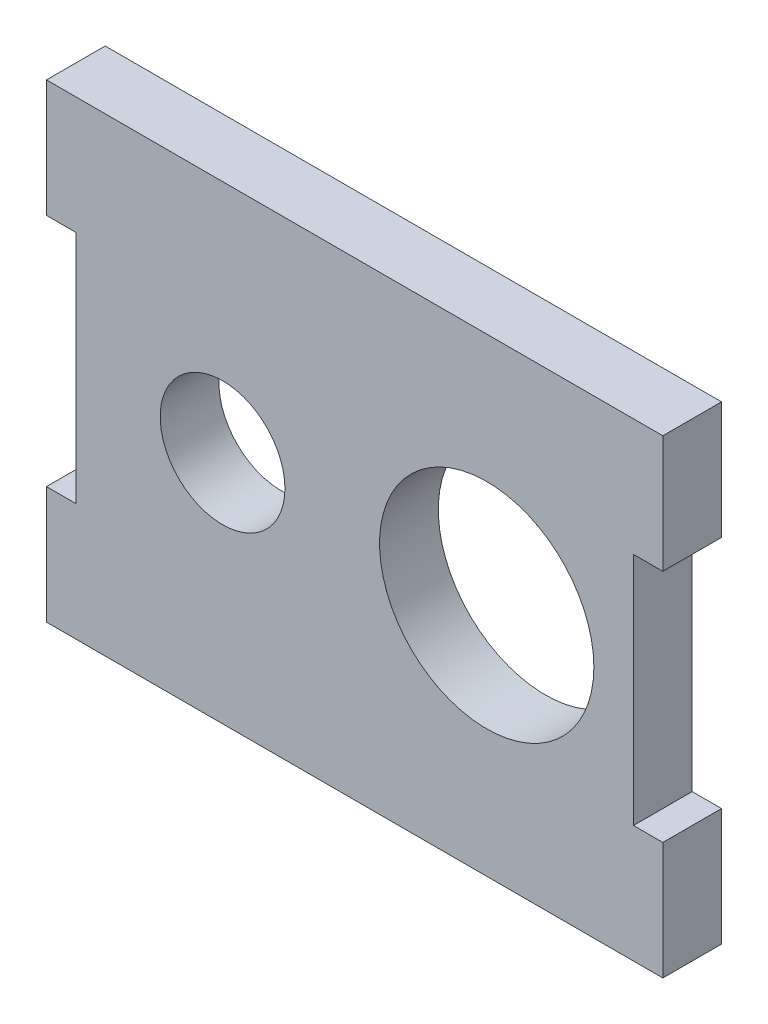
from build123d import *

# Parameters (mm, degrees)
SKETCH1_R      = 3.65
SKETCH1_R_2    = 2.125
EXTRUDE1_DEPTH = 2


with BuildPart() as part:
    # Sketch1 → Extrude1 (new body)
    with BuildSketch(Plane.XY):
        Polygon((543.697024667, -406.673514651), (522.697024667, -406.673514651), (522.697024667, -402.673514651), (523.697024667, -402.673514651), (523.697024667, -394.673514651), (522.697024667, -394.673514651), (522.697024667, -390.673514651), (543.697024667, -390.673514651), (543.697024667, -394.673514651), (542.697024667, -394.673514651), (542.697024667, -402.673514651), (543.697024667, -402.673514651), align=None)
        with Locations((537.697024667, -398.673514651)):
            Circle(SKETCH1_R, mode=Mode.SUBTRACT)
        with Locations((528.697024667, -398.673514651)):
            Circle(SKETCH1_R_2, mode=Mode.SUBTRACT)
    extrude(amount=EXTRUDE1_DEPTH)


solid = part.part
